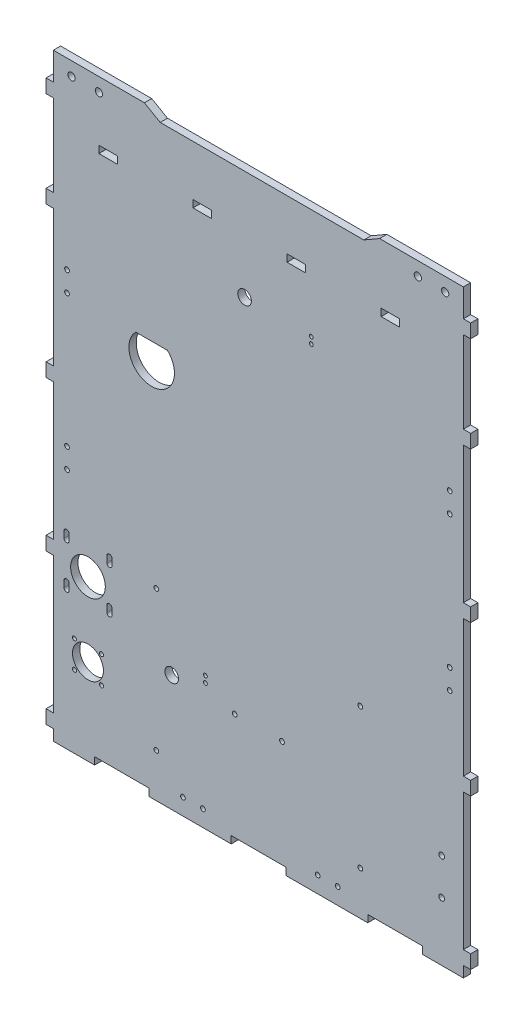
from build123d import *

# Parameters (mm, degrees)
BOSS_EXTRU_1_DEPTH           = 8
ESQUISSE3_W                  = 20.3
ESQUISSE3_H                  = 8
ENL_V_MAT_EXTRU_1_DEPTH      = 8
ENL_V_MAT_EXTRU_2_DEPTH      = 10
ENL_V_MAT_EXTRU_3_DEPTH      = 757.11943364
ENL_V_MAT_EXTRU_3_DEPTH_BACK = 10
ESQUISSE5_W                  = 8
ESQUISSE5_H                  = 150
ESQUISSE5_H_2                = 12
ESQUISSE5_H_3                = 90
ESQUISSE5_H_4                = 30.343253
BOSS_EXTRU_2_DEPTH           = 8
ESQUISSE7_R                  = 19.05
ENL_V_MAT_EXTRU_4_DEPTH      = 10
ESQUISSE8_R                  = 2.8
ENL_V_MAT_EXTRU_5_DEPTH      = 10
ESQUISSE9_R                  = 3.15
ENL_V_MAT_EXTRU_6_DEPTH      = 10
ESQUISSE10_R                 = 2.65
ENL_V_MAT_EXTRU_7_DEPTH      = 10
ESQUISSE12_W                 = 60
ESQUISSE12_H                 = 8
ENL_V_MAT_EXTRU_8_DEPTH      = 10
ESQUISSE13_R                 = 2.6
ENL_V_MAT_EXTRU_9_DEPTH      = 10
ESQUISSE15_R                 = 2.6
ENL_V_MAT_EXTRU_10_DEPTH     = 10
ESQUISSE16_R                 = 2.6
ENL_V_MAT_EXTRU_11_DEPTH     = 10
ESQUISSE17_R                 = 4
ENL_V_MAT_EXTRU_12_DEPTH     = 10
ESQUISSE18_R                 = 2.1
ENL_V_MAT_EXTRU_13_DEPTH     = 10
ENL_V_MAT_EXTRU_14_DEPTH     = 10
ESQUISSE20_R                 = 25
ENL_V_MAT_EXTRU_15_DEPTH     = 10
BOSS_EXTRU_3_START           = -8
BOSS_EXTRU_3_DEPTH           = 8
ESQUISSE22_R                 = 7.5
ENL_V_MAT_EXTRU_16_DEPTH     = 10
ESQUISSE23_R                 = 2.6
ENL_V_MAT_EXTRU_17_DEPTH     = 10


with BuildPart() as part:
    # Esquisse2 → Boss.-Extru.1 (new body)
    with BuildSketch(Plane.XY.offset(-12)):
        Polygon((0, -56), (458.3, -56), (458.3, 601.343253), (0, 601.343253), (0, 571), (-8, 571), (-8, 556), (0, 556), (0, 466), (-8, 466), (-8, 451), (0, 451), (0, 301), (-8, 301), (-8, 286), (0, 286), (0, 136), (-8, 136), (-8, 121), (0, 121), (0, -29), (-8, -29), (-8, -44), (0, -44), align=None)
        with BuildLine():
            ThreePointArc((17, 53.829709717), (19.615223689, 56.884776311), (22.670290283, 59.5))
            Line((22.670290283, 59.5), (53.329709717, 59.5))
            ThreePointArc((53.329709717, 59.5), (56.384776311, 56.884776311), (59, 53.829709717))
            Line((59, 53.829709717), (59, 23.170290283))
            ThreePointArc((59, 23.170290283), (56.384776311, 20.115223689), (53.329709717, 17.5))
            Line((53.329709717, 17.5), (22.670290283, 17.5))
            ThreePointArc((22.670290283, 17.5), (19.615223689, 20.115223689), (17, 23.170290283))
            Line((17, 23.170290283), (17, 53.829709717))
        make_face(mode=Mode.SUBTRACT)
    extrude(amount=BOSS_EXTRU_1_DEPTH)

    # Esquisse3 → Enlèv. mat.-Extru.1 (cut)
    with BuildSketch(Plane.XY.offset(-4)):
        with Locations((163.483333333, 532)):
            Rectangle(ESQUISSE3_W, ESQUISSE3_H)
        with Locations((60.15, 532)):
            Rectangle(ESQUISSE3_W, ESQUISSE3_H)
        with Locations((266.816666667, 532)):
            Rectangle(ESQUISSE3_W, ESQUISSE3_H)
        with Locations((370.15, 532)):
            Rectangle(ESQUISSE3_W, ESQUISSE3_H)
    extrude(amount=-ENL_V_MAT_EXTRU_1_DEPTH, mode=Mode.SUBTRACT)

    # Esquisse4 → Enlèv. mat.-Extru.2 (cut)
    with BuildSketch(Plane.XY.offset(-4)):
        Polygon((358.3, 601.343253), (340.979491924, 591.343253), (117.320508076, 591.343253), (100, 601.343253), align=None)
    extrude(amount=-ENL_V_MAT_EXTRU_2_DEPTH, mode=Mode.SUBTRACT)

    # Esquisse5 → Enlèv. mat.-Extru.3 (cut, two sides: drawn at the far end of the back side and taken through both)
    with BuildSketch(Plane.XY.offset(-4).offset(-ENL_V_MAT_EXTRU_3_DEPTH_BACK)):
        with Locations((454.3, 46)):
            Rectangle(ESQUISSE5_W, ESQUISSE5_H)
        with Locations((454.3, -50)):
            Rectangle(ESQUISSE5_W, ESQUISSE5_H_2)
        with Locations((454.3, 211)):
            Rectangle(ESQUISSE5_W, ESQUISSE5_H)
        with Locations((454.3, 376)):
            Rectangle(ESQUISSE5_W, ESQUISSE5_H)
        with Locations((454.3, 511)):
            Rectangle(ESQUISSE5_W, ESQUISSE5_H_3)
        with Locations((454.3, 586.1716265)):
            Rectangle(ESQUISSE5_W, ESQUISSE5_H_4)
    extrude(amount=ENL_V_MAT_EXTRU_3_DEPTH + ENL_V_MAT_EXTRU_3_DEPTH_BACK, mode=Mode.SUBTRACT)

    # Esquisse6 → Boss.-Extru.2 (add)
    with BuildSketch(Plane.XY.offset(-12)):
        with BuildLine():
            Line((17, 53.829709717), (17, 23.170290283))
            ThreePointArc((17, 23.170290283), (19.615223689, 20.115223689), (22.670290283, 17.5))
            Line((22.670290283, 17.5), (53.329709717, 17.5))
            ThreePointArc((53.329709717, 17.5), (56.384776311, 20.115223689), (59, 23.170290283))
            Line((59, 23.170290283), (59, 53.829709717))
            ThreePointArc((59, 53.829709717), (56.384776311, 56.884776311), (53.329709717, 59.5))
            Line((53.329709717, 59.5), (22.670290283, 59.5))
            ThreePointArc((22.670290283, 59.5), (19.615223689, 56.884776311), (17, 53.829709717))
        make_face()
        with BuildLine():
            ThreePointArc((55, 38.5), (38, 55.5), (21, 38.5))
            ThreePointArc((21, 38.5), (38, 21.5), (55, 38.5))
        make_face(mode=Mode.SUBTRACT)
        with BuildLine():
            ThreePointArc((25.400757595, 53.349242405), (23.150757595, 55.599242405), (20.900757595, 53.349242405))
            ThreePointArc((20.900757595, 53.349242405), (23.150757595, 51.099242405), (25.400757595, 53.349242405))
        make_face(mode=Mode.SUBTRACT)
        with BuildLine():
            ThreePointArc((50.599242405, 53.349242405), (52.849242405, 51.099242405), (55.099242405, 53.349242405))
            ThreePointArc((55.099242405, 53.349242405), (52.849242405, 55.599242405), (50.599242405, 53.349242405))
        make_face(mode=Mode.SUBTRACT)
        with BuildLine():
            ThreePointArc((55.099242405, 23.650757595), (52.849242405, 25.900757595), (50.599242405, 23.650757595))
            ThreePointArc((50.599242405, 23.650757595), (52.849242405, 21.400757595), (55.099242405, 23.650757595))
        make_face(mode=Mode.SUBTRACT)
        with BuildLine():
            ThreePointArc((25.400757595, 23.650757595), (23.150757595, 25.900757595), (20.900757595, 23.650757595))
            ThreePointArc((20.900757595, 23.650757595), (23.150757595, 21.400757595), (25.400757595, 23.650757595))
        make_face(mode=Mode.SUBTRACT)
    extrude(amount=BOSS_EXTRU_2_DEPTH)

    # Esquisse7 → Enlèv. mat.-Extru.4 (cut)
    with BuildSketch(Plane.XY.offset(-4)):
        with Locations((38, 119.5)):
            Circle(ESQUISSE7_R)
    extrude(amount=-ENL_V_MAT_EXTRU_4_DEPTH, mode=Mode.SUBTRACT)

    # Esquisse8 → Enlèv. mat.-Extru.5 (cut)
    with BuildSketch(Plane.XY.offset(-4)):
        with Locations((61.55, 143.05)):
            Circle(ESQUISSE8_R)
        with Locations((14.45, 143.05)):
            Circle(ESQUISSE8_R)
        with Locations((14.45, 95.95)):
            Circle(ESQUISSE8_R)
        with Locations((61.55, 95.95)):
            Circle(ESQUISSE8_R)
    extrude(amount=-ENL_V_MAT_EXTRU_5_DEPTH, mode=Mode.SUBTRACT)

    # Esquisse9 → Enlèv. mat.-Extru.6 (cut)
    with BuildSketch(Plane.XY.offset(-4)):
        with Locations((426.5, 48.5)):
            Circle(ESQUISSE9_R)
        with Locations((426.5, 8.5)):
            Circle(ESQUISSE9_R)
    extrude(amount=-ENL_V_MAT_EXTRU_6_DEPTH, mode=Mode.SUBTRACT)

    # Esquisse10 → Enlèv. mat.-Extru.7 (cut)
    with BuildSketch(Plane.XY.offset(-4)):
        with Locations((251.15, 69.5)):
            Circle(ESQUISSE10_R)
        with Locations((199.15, 69.5)):
            Circle(ESQUISSE10_R)
    extrude(amount=-ENL_V_MAT_EXTRU_7_DEPTH, mode=Mode.SUBTRACT)

    # Esquisse12 → Enlèv. mat.-Extru.8 (cut)
    with BuildSketch(Plane(origin=(0, 0, -12), x_dir=(-1, 0, 0), z_dir=(0, 0, -1))):
        with Locations((-375.3, -52)):
            Rectangle(ESQUISSE12_W, ESQUISSE12_H)
        with Locations((-225.3, -52)):
            Rectangle(ESQUISSE12_W, ESQUISSE12_H)
        with Locations((-75.3, -52)):
            Rectangle(ESQUISSE12_W, ESQUISSE12_H)
    extrude(amount=-ENL_V_MAT_EXTRU_8_DEPTH, mode=Mode.SUBTRACT)

    # Esquisse13 → Enlèv. mat.-Extru.9 (cut)
    with BuildSketch(Plane.XY.offset(-4)):
        with Locations((312.3, -38)):
            Circle(ESQUISSE13_R)
        with Locations((290.3, -38)):
            Circle(ESQUISSE13_R)
        with Locations((164.3, -38)):
            Circle(ESQUISSE13_R)
        with Locations((142.3, -38)):
            Circle(ESQUISSE13_R)
    extrude(amount=-ENL_V_MAT_EXTRU_9_DEPTH, mode=Mode.SUBTRACT)

    # Esquisse15 → Enlèv. mat.-Extru.10 (cut)
    with BuildSketch(Plane(origin=(0, 0, -12), x_dir=(-1, 0, 0), z_dir=(0, 0, -1))):
        with Locations((-435.3, 378)):
            Circle(ESQUISSE15_R)
        with Locations((-435.3, 400)):
            Circle(ESQUISSE15_R)
        with Locations((-15, 378)):
            Circle(ESQUISSE15_R)
        with Locations((-15, 400)):
            Circle(ESQUISSE15_R)
    extrude(amount=-ENL_V_MAT_EXTRU_10_DEPTH, mode=Mode.SUBTRACT)

    # Esquisse16 → Enlèv. mat.-Extru.11 (cut)
    with BuildSketch(Plane.XY.offset(-4)):
        with Locations((337.15, 146)):
            Circle(ESQUISSE16_R)
        with Locations((113.15, 146)):
            Circle(ESQUISSE16_R)
        with Locations((113.15, -8)):
            Circle(ESQUISSE16_R)
        with Locations((337.15, -8)):
            Circle(ESQUISSE16_R)
    extrude(amount=-ENL_V_MAT_EXTRU_11_DEPTH, mode=Mode.SUBTRACT)

    # Esquisse17 → Enlèv. mat.-Extru.12 (cut)
    with BuildSketch(Plane.XY.offset(-4)):
        with Locations((20, 586.343253)):
            Circle(ESQUISSE17_R)
        with Locations((50, 586.343253)):
            Circle(ESQUISSE17_R)
        with Locations((400.3, 586.343253)):
            Circle(ESQUISSE17_R)
        with Locations((430.3, 586.343253)):
            Circle(ESQUISSE17_R)
    extrude(amount=-ENL_V_MAT_EXTRU_12_DEPTH, mode=Mode.SUBTRACT)

    # Esquisse18 → Enlèv. mat.-Extru.13 (cut)
    with BuildSketch(Plane(origin=(0, 0, -12), x_dir=(-1, 0, 0), z_dir=(0, 0, -1))):
        with Locations((-167, 90)):
            Circle(ESQUISSE18_R)
        with Locations((-167, 83)):
            Circle(ESQUISSE18_R)
        with Locations((-283.3, 470.5)):
            Circle(ESQUISSE18_R)
        with Locations((-283.3, 463.5)):
            Circle(ESQUISSE18_R)
    extrude(amount=-ENL_V_MAT_EXTRU_13_DEPTH, mode=Mode.SUBTRACT)

    # Esquisse19 → Enlèv. mat.-Extru.14 (cut)
    with BuildSketch(Plane.XY.offset(-4)):
        with BuildLine():
            Line((11.65, 143.05), (11.65, 150.05))
            ThreePointArc((11.65, 150.05), (14.45, 152.85), (17.25, 150.05))
            Line((17.25, 150.05), (17.25, 143.05))
            ThreePointArc((17.25, 143.05), (14.45, 140.25), (11.65, 143.05))
        make_face()
        with BuildLine():
            Line((58.75, 143.05), (58.75, 150.05))
            ThreePointArc((58.75, 150.05), (61.55, 152.85), (64.35, 150.05))
            Line((64.35, 150.05), (64.35, 143.05))
            ThreePointArc((64.35, 143.05), (61.55, 140.25), (58.75, 143.05))
        make_face()
        with BuildLine():
            Line((58.75, 95.95), (58.75, 102.95))
            ThreePointArc((58.75, 102.95), (61.55, 105.75), (64.35, 102.95))
            Line((64.35, 102.95), (64.35, 95.95))
            ThreePointArc((64.35, 95.95), (61.55, 93.15), (58.75, 95.95))
        make_face()
        with BuildLine():
            Line((11.65, 95.95), (11.65, 102.95))
            ThreePointArc((11.65, 102.95), (14.45, 105.75), (17.25, 102.95))
            Line((17.25, 102.95), (17.25, 95.95))
            ThreePointArc((17.25, 95.95), (14.45, 93.15), (11.65, 95.95))
        make_face()
    extrude(amount=-ENL_V_MAT_EXTRU_14_DEPTH, mode=Mode.SUBTRACT)

    # Esquisse20 → Enlèv. mat.-Extru.15 (cut)
    with BuildSketch(Plane.XY.offset(-4)):
        with Locations((108, 360.5)):
            Circle(ESQUISSE20_R)
    extrude(amount=-ENL_V_MAT_EXTRU_15_DEPTH, mode=Mode.SUBTRACT)

    # Esquisse21 → Boss.-Extru.3 (add)
    with BuildSketch(Plane(origin=(0, 0, -12), x_dir=(-1, 0, 0), z_dir=(0, 0, -1)).offset(BOSS_EXTRU_3_START)):
        with BuildLine():
            Line((-90.650648427, 378.5), (-125.349351573, 378.5))
            ThreePointArc((-125.349351573, 378.5), (-108, 385.5), (-90.650648427, 378.5))
        make_face()
    extrude(amount=BOSS_EXTRU_3_DEPTH)

    # Esquisse22 → Enlèv. mat.-Extru.16 (cut)
    with BuildSketch(Plane(origin=(0, 0, -12), x_dir=(-1, 0, 0), z_dir=(0, 0, -1))):
        with Locations((-210, 471.343253)):
            Circle(ESQUISSE22_R)
        with Locations((-130, 72)):
            Circle(ESQUISSE22_R)
    extrude(amount=-ENL_V_MAT_EXTRU_16_DEPTH, mode=Mode.SUBTRACT)

    # Esquisse23 → Enlèv. mat.-Extru.17 (cut)
    with BuildSketch(Plane(origin=(0, 0, -12), x_dir=(-1, 0, 0), z_dir=(0, 0, -1))):
        with Locations((-435.3, 232)):
            Circle(ESQUISSE23_R)
        with Locations((-435.3, 210)):
            Circle(ESQUISSE23_R)
        with Locations((-15, 232)):
            Circle(ESQUISSE23_R)
        with Locations((-15, 210)):
            Circle(ESQUISSE23_R)
    extrude(amount=-ENL_V_MAT_EXTRU_17_DEPTH, mode=Mode.SUBTRACT)


solid = part.part
